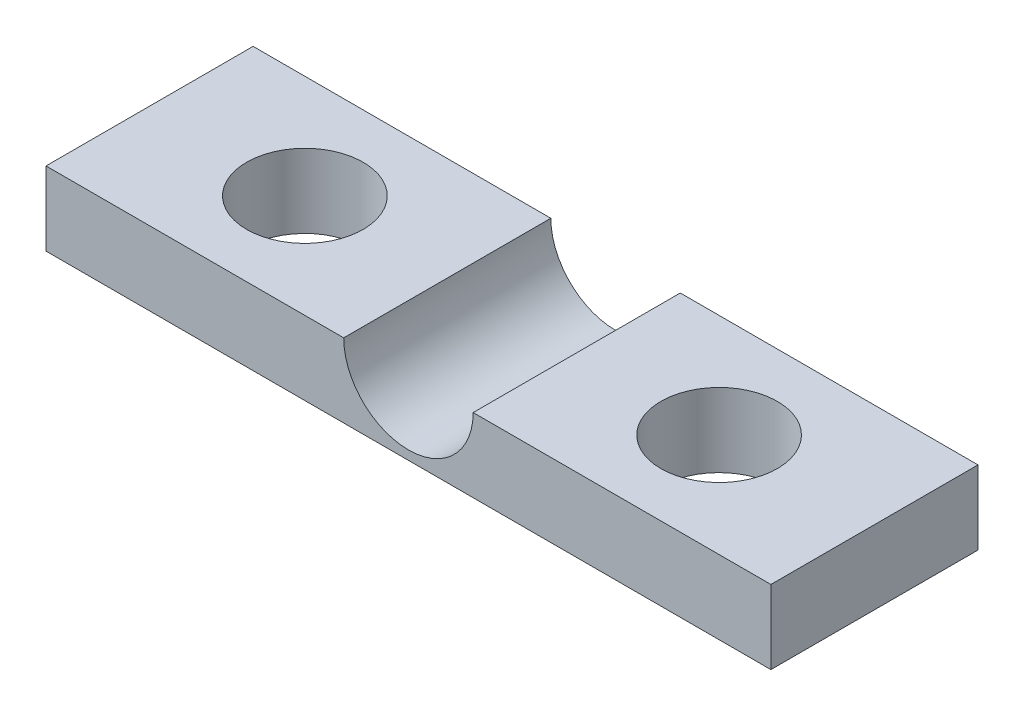
from build123d import *

# Parameters (mm, degrees)
BOSS_EXTRUDE1_DEPTH = 8
CUT_EXTRUDE1_REACH  = 31.26
SKETCH2_R           = 2.25


with BuildPart() as part:
    # Sketch1 → Boss-Extrude1 (new body)
    with BuildSketch(Plane.XY):
        with BuildLine():
            Line((0, 0), (-28, 0))
            Line((-28, 0), (-28, 2.85))
            Line((-28, 2.85), (-16.5, 2.85))
            ThreePointArc((-16.5, 2.85), (-14, 0.35), (-11.5, 2.85))
            Line((-11.5, 2.85), (0, 2.85))
            Line((0, 2.85), (0, 0))
        make_face()
    extrude(amount=BOSS_EXTRUDE1_DEPTH)

    # Sketch2 → Cut-Extrude1 (cut, up to next)
    with BuildSketch(Plane(origin=(0, 2.85, 0), x_dir=(1, 0, 0), z_dir=(0, 1, 0)), mode=Mode.PRIVATE) as cut_extrude1_sk1:
        with Locations(Location((-22, -4, 0), (0, 0, 270))):
            Circle(SKETCH2_R)
    cut_extrude1_tool1 = extrude(cut_extrude1_sk1.sketch, amount=-CUT_EXTRUDE1_REACH, mode=Mode.PRIVATE) & part.part
    # Sketch2 → Cut-Extrude1 (cut, up to next)
    with BuildSketch(Plane(origin=(0, 2.85, 0), x_dir=(1, 0, 0), z_dir=(0, 1, 0)), mode=Mode.PRIVATE) as cut_extrude1_sk2:
        with Locations(Location((-6, -4, 0), (0, 0, 270))):
            Circle(SKETCH2_R)
    cut_extrude1_tool2 = extrude(cut_extrude1_sk2.sketch, amount=-CUT_EXTRUDE1_REACH, mode=Mode.PRIVATE) & part.part
    add(cut_extrude1_tool1.solids().sort_by_distance((-22, 2.85, 4))[0], mode=Mode.SUBTRACT)
    add(cut_extrude1_tool2.solids().sort_by_distance((-6, 2.85, 4))[0], mode=Mode.SUBTRACT)


solid = part.part
